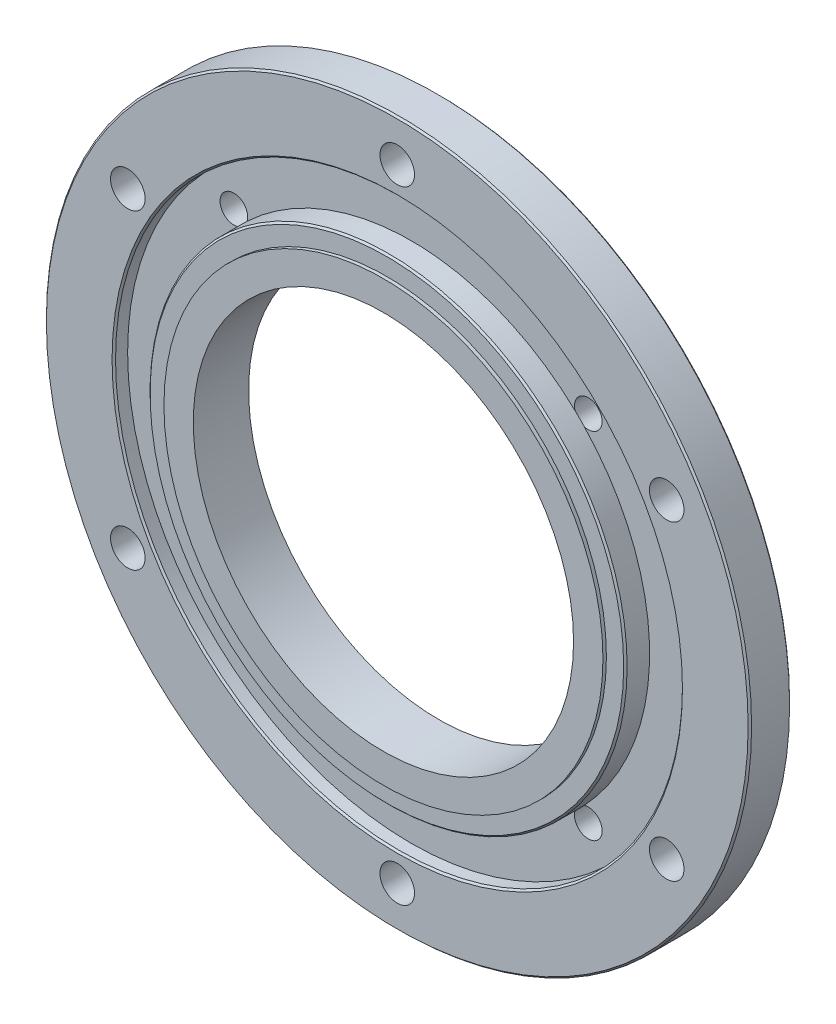
from build123d import *

# Parameters (mm, degrees)
SKETCH_1_R          = 102
EXTRUDE_1_DEPTH     = 12
SKETCH_2_R          = 69
EXTRUDE_2_DEPTH     = 3
SKETCH_3_R          = 63.5
EXTRUDE_3_DEPTH     = 1
SKETCH_4_R          = 55
CUT_EXTRUDE_1_DEPTH = 146.134420452
CUT_EXTRUDE_START   = -8
SKETCH_5_R          = 82
SKETCH_5_R_2        = 69
CUT_EXTRUDE_2_DEPTH = 4
SKETCH_6_R          = 4
CUT_EXTRUDE_3_DEPTH = 8
SKETCH_7_R          = 5
CUT_EXTRUDE_4_DEPTH = 146.134420452
CHAMFER_1_SIZE      = 0.5


with BuildPart() as part:
    # 草图1 → 凸台-拉伸1 (new body)
    with BuildSketch(Plane.XY):
        Circle(SKETCH_1_R)
    extrude(amount=EXTRUDE_1_DEPTH)

    # 草图2 → 凸台-拉伸2 (add)
    with BuildSketch(Plane.XY.offset(12)):
        Circle(SKETCH_2_R)
    extrude(amount=EXTRUDE_2_DEPTH)

    # 草图3 → 凸台-拉伸3 (add)
    with BuildSketch(Plane.XY.offset(15)):
        Circle(SKETCH_3_R)
    extrude(amount=EXTRUDE_3_DEPTH)

    # 草图4 → 切除-拉伸1 (cut, through all)
    with BuildSketch(Plane.XY.offset(16)):
        Circle(SKETCH_4_R)
    extrude(amount=-CUT_EXTRUDE_1_DEPTH, mode=Mode.SUBTRACT)

    # 草图5 → 切除-拉伸2 (cut)
    with BuildSketch(Plane.XY.offset(16).offset(CUT_EXTRUDE_START)):
        Circle(SKETCH_5_R)
        Circle(SKETCH_5_R_2, mode=Mode.SUBTRACT)
    extrude(amount=CUT_EXTRUDE_2_DEPTH, mode=Mode.SUBTRACT)

    # 草图6 → 切除-拉伸3 (cut)
    with BuildSketch(Plane.XY):
        with Locations(Location((-51.265241636, 51.265241636, 0), (0, 0, 286.819656348))):
            Circle(SKETCH_6_R)
        with Locations(Location((51.265241636, 51.265241636, 0), (0, 0, 180))):
            Circle(SKETCH_6_R)
        with Locations(Location((51.265241636, -51.265241636, 0), (0, 0, 163.180343652))):
            Circle(SKETCH_6_R)
        with Locations(Location((-51.265241636, -51.265241636, 0), (0, 0, 180))):
            Circle(SKETCH_6_R)
    extrude(amount=CUT_EXTRUDE_3_DEPTH, mode=Mode.SUBTRACT)

    # 草图7 → 切除-拉伸4 (cut, through all)
    with BuildSketch(Plane(origin=(0, 0, 0), x_dir=(-1, 0, 0), z_dir=(0, 0, -1))):
        with Locations((-77.942286341, 45)):
            Circle(SKETCH_7_R)
        with Locations((0, 90)):
            Circle(SKETCH_7_R)
        with Locations((77.942286341, 45)):
            Circle(SKETCH_7_R)
        with Locations((77.942286341, -45)):
            Circle(SKETCH_7_R)
        with Locations((0, -90)):
            Circle(SKETCH_7_R)
        with Locations((-77.942286341, -45)):
            Circle(SKETCH_7_R)
    extrude(amount=-CUT_EXTRUDE_4_DEPTH, mode=Mode.SUBTRACT)

    # 倒角1
    chamfer_1_edges = [part.edges().sort_by_distance(p)[0] for p in [
        (-82, 0, 12),
        (-102, 0, 0),
        (-102, 0, 12),
        (-69, 0, 15),
    ]]
    chamfer(chamfer_1_edges, length=CHAMFER_1_SIZE)


solid = part.part
